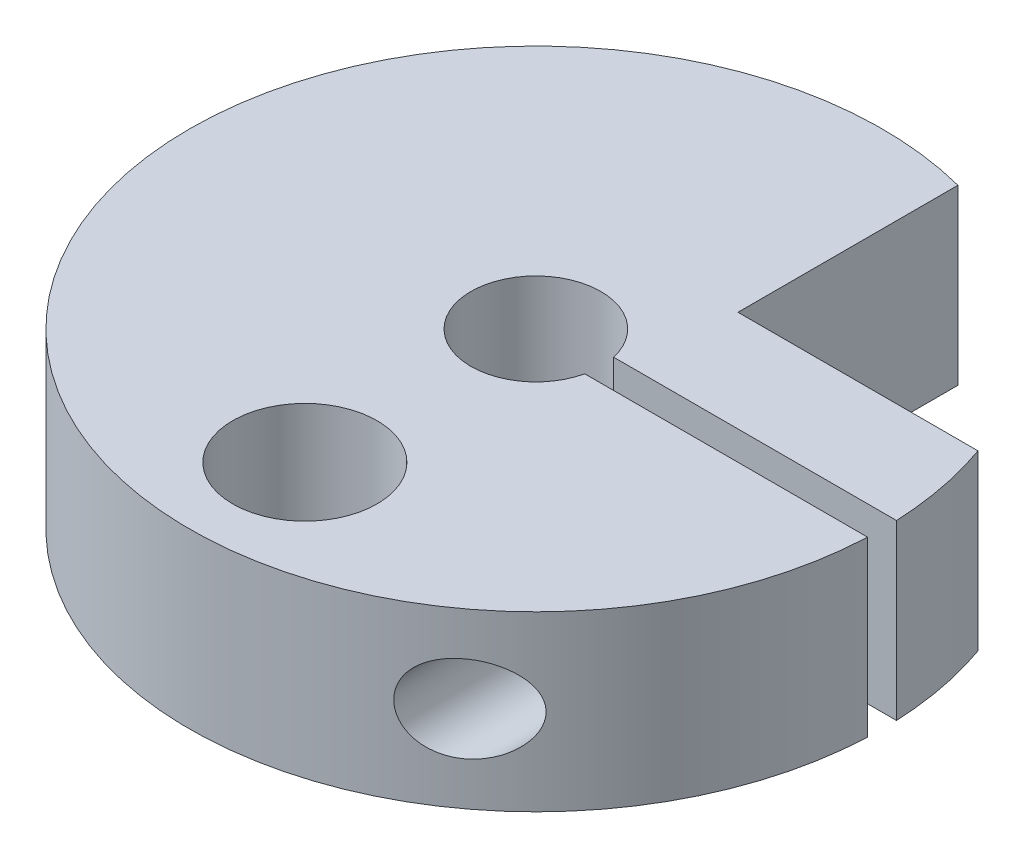
from build123d import *

# Parameters (mm, degrees)
SKETCH1_R           = 2.5
BOSS_EXTRUDE1_DEPTH = 6
SKETCH3_R           = 1.5
CUT_EXTRUDE2_DEPTH  = 16


with BuildPart() as part:
    # Sketch1 → Boss-Extrude1 (new body)
    with BuildSketch(Plane(origin=(0, 0, 0), x_dir=(1, 0, 0), z_dir=(0, 1, 0))):
        with BuildLine():
            Line((2.193741097, 0.5), (11.989578808, 0.5))
            ThreePointArc((11.989578808, 0.5), (11.782329983, 2.275236289), (11.313708499, 4))
            Line((11.313708499, 4), (3, 4))
            Line((3, 4), (3, 11.618950039))
            ThreePointArc((3, 11.618950039), (-9.637899446, -7.149188365), (11.989578808, -0.5))
            Line((11.989578808, -0.5), (2.193741097, -0.5))
            ThreePointArc((2.193741097, -0.5), (-2.25, 0), (2.193741097, 0.5))
        make_face()
        with Locations(Location((0, -8, 0), (0, 0, 270))):
            Circle(SKETCH1_R, mode=Mode.SUBTRACT)
    extrude(amount=BOSS_EXTRUDE1_DEPTH)

    # Sketch3 → Cut-Extrude2 (cut)
    with BuildSketch(Plane(origin=(0, 0, -4), x_dir=(-1, 0, 0), z_dir=(0, 0, -1))):
        with Locations((-7.16, 3)):
            Circle(SKETCH3_R)
    extrude(amount=-CUT_EXTRUDE2_DEPTH, mode=Mode.SUBTRACT)


solid = part.part
